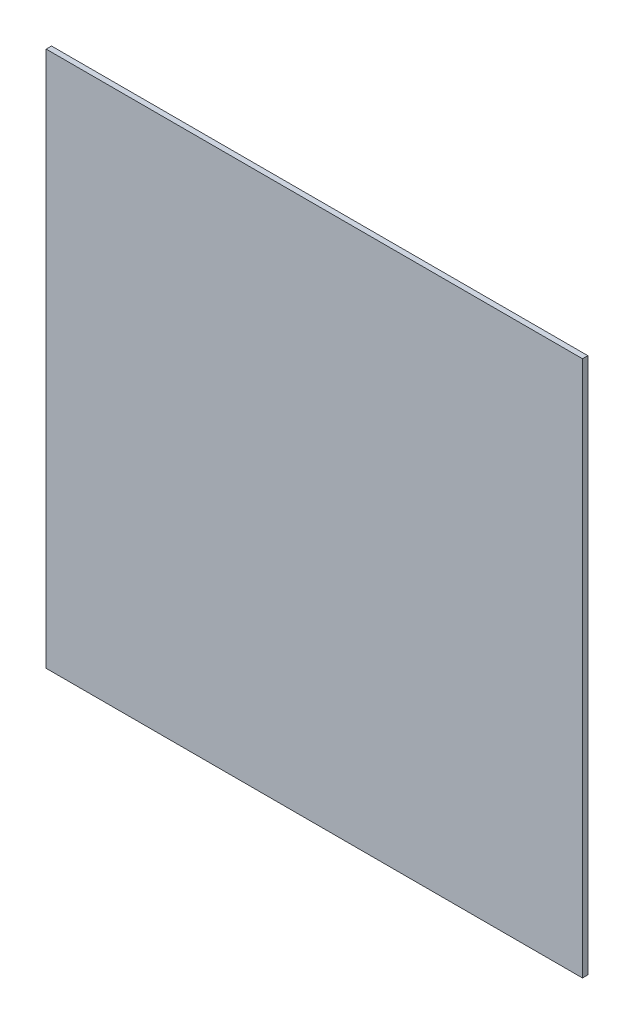
from build123d import *

# Parameters (mm, degrees)
SKETCH1_W           = 400
SKETCH1_H           = 400
BOSS_EXTRUDE1_DEPTH = 4


with BuildPart() as part:
    # Sketch1 → Boss-Extrude1 (new body)
    with BuildSketch(Plane.XY):
        with Locations((200, -200)):
            Rectangle(SKETCH1_W, SKETCH1_H)
    extrude(amount=BOSS_EXTRUDE1_DEPTH)


solid = part.part
